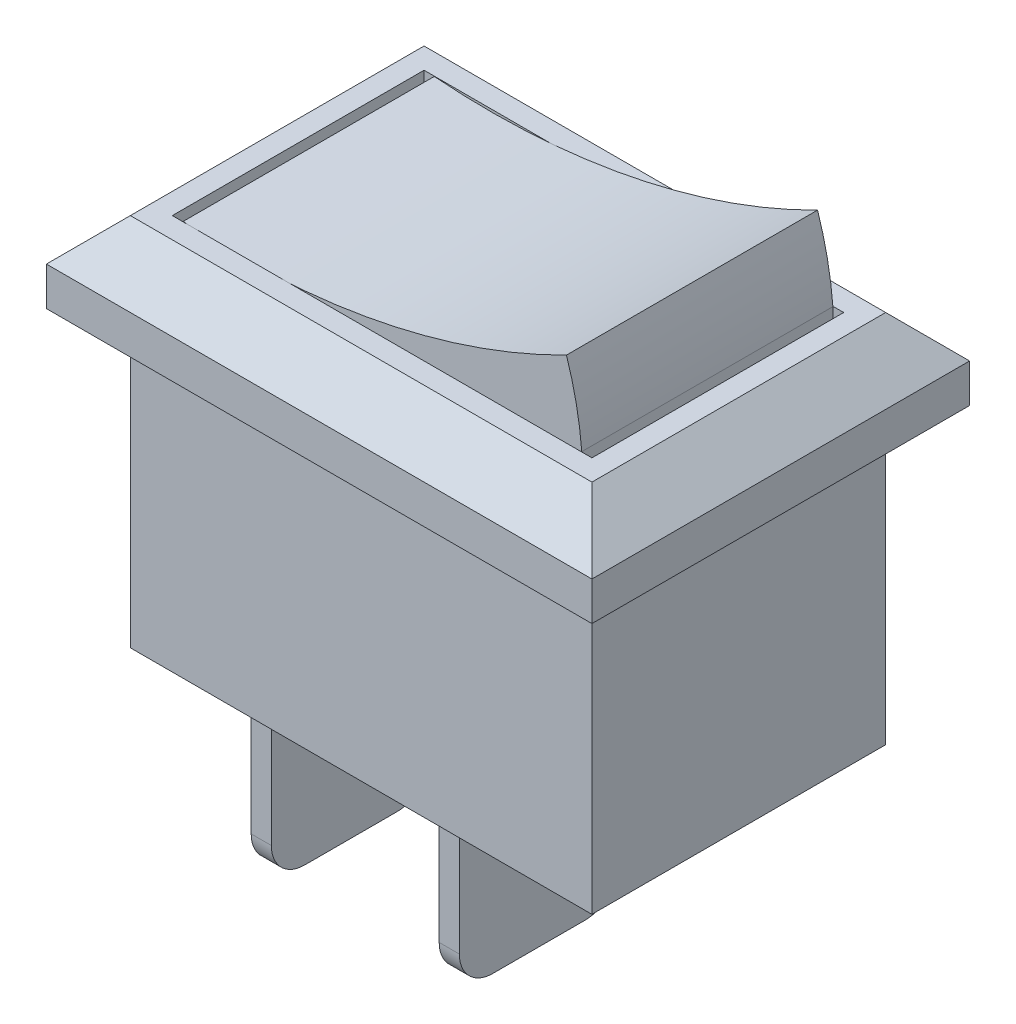
from build123d import *

# Parameters (mm, degrees)
SKETCH1_W                = 17.4625
SKETCH1_H                = 11.1125
BOSS_EXTRUDE1_DEPTH      = 11.1125
SKETCH2_W                = 20.6375
SKETCH2_H                = 14.2875
BOSS_EXTRUDE2_DEPTH      = 3.048
CHAMFER1_SIZE            = 1.5875
SKETCH3_W                = 15.875
SKETCH3_H                = 9.525
CUT_EXTRUDE1_DEPTH       = 3.175
BOSS_EXTRUDE3_DEPTH      = 4.7498
BOSS_EXTRUDE3_DEPTH_BACK = 4.7498
SKETCH5_W                = 0.762
SKETCH5_H                = 6.0325
BOSS_EXTRUDE4_DEPTH      = 7.62
FILLET1_R                = 1.27


with BuildPart() as part:
    # Sketch1 → Boss-Extrude1 (new body)
    with BuildSketch(Plane(origin=(0, 0, 0), x_dir=(1, 0, 0), z_dir=(0, 1, 0))):
        with Locations((8.73125, 5.55625)):
            Rectangle(SKETCH1_W, SKETCH1_H)
    extrude(amount=BOSS_EXTRUDE1_DEPTH)

    # Sketch2 → Boss-Extrude2 (add)
    with BuildSketch(Plane(origin=(0, 11.1125, 0), x_dir=(1, 0, 0), z_dir=(0, 1, 0))):
        with Locations((8.73125, 5.55625)):
            Rectangle(SKETCH2_W, SKETCH2_H)
    extrude(amount=BOSS_EXTRUDE2_DEPTH)

    # Chamfer1
    chamfer1_edges = [part.edges().sort_by_distance(p)[0] for p in [
        (-1.5875, 14.1605, -5.55625),
        (8.73125, 14.1605, 1.5875),
        (19.05, 14.1605, -5.55625),
        (8.73125, 14.1605, -12.7),
    ]]
    chamfer(chamfer1_edges, length=CHAMFER1_SIZE)

    # Sketch3 → Cut-Extrude1 (cut)
    with BuildSketch(Plane(origin=(0, 14.1605, 0), x_dir=(1, 0, 0), z_dir=(0, 1, 0))):
        with Locations((8.73125, 5.55625)):
            Rectangle(SKETCH3_W, SKETCH3_H)
    extrude(amount=-CUT_EXTRUDE1_DEPTH, mode=Mode.SUBTRACT)

    # Sketch4 → Boss-Extrude3 (add, two sides: drawn at the far end of the back side and taken through both)
    with BuildSketch(Plane.XY.offset(-5.55625).offset(-BOSS_EXTRUDE3_DEPTH_BACK)):
        with BuildLine():
            Line((1.190625, 10.9855), (16.271875, 10.9855))
            Line((16.271875, 10.9855), (16.271875, 14.1605))
            add(Edge.make_bspline(
                [(16.271875, 14.1605), (16.153461698, 15.632290366), (15.692407357, 17.033048026)],
                knots=[0, 0, 0, 1, 1, 1], degree=2))
            ThreePointArc((15.692407357, 17.033048026), (8.639200608, 14.598783188), (1.190625, 14.1605))
            Line((1.190625, 14.1605), (1.190625, 10.9855))
        make_face()
    extrude(amount=BOSS_EXTRUDE3_DEPTH + BOSS_EXTRUDE3_DEPTH_BACK)

    # Sketch5 → Boss-Extrude4 (add)
    with BuildSketch(Plane.XZ):
        with Locations((2.413, -5.55625)):
            Rectangle(SKETCH5_W, SKETCH5_H)
        with Locations((9.525, -5.55625)):
            Rectangle(SKETCH5_W, SKETCH5_H)
    extrude(amount=BOSS_EXTRUDE4_DEPTH)

    # Fillet1
    fillet1_edges = [part.edges().sort_by_distance(p)[0] for p in [
        (2.413, -7.62, -8.5725),
        (2.413, -7.62, -2.54),
        (9.525, -7.62, -8.5725),
        (9.525, -7.62, -2.54),
    ]]
    fillet(fillet1_edges, radius=FILLET1_R)


solid = part.part
